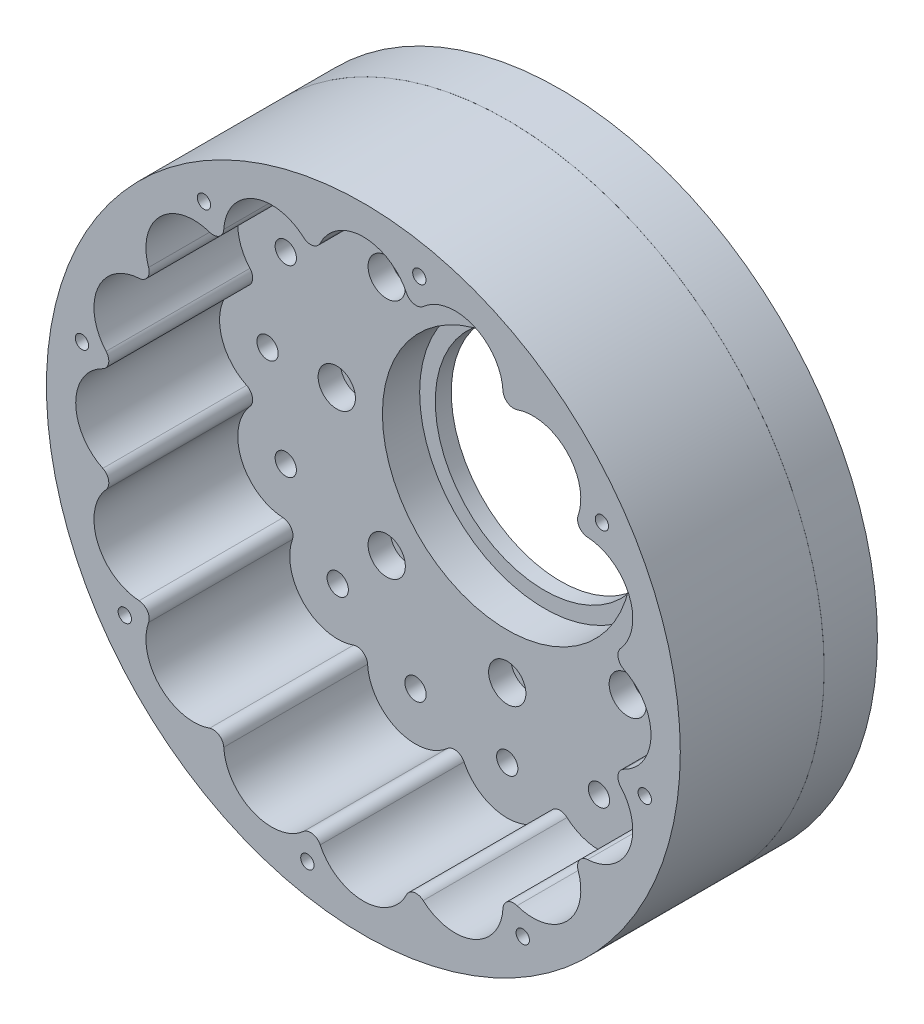
from build123d import *

# Parameters (mm, degrees)
SKETCH1_R           = 59.5
BOSS_EXTRUDE1_DEPTH = 10
SKETCH2_R           = 59.5
BOSS_EXTRUDE3_DEPTH = 27
SKETCH3_R           = 2
CUT_EXTRUDE1_DEPTH  = 4
SKETCH4_R           = 23.435
CUT_EXTRUDE2_DEPTH  = 7
SKETCH5_R           = 20.5
CUT_EXTRUDE3_DEPTH  = 91.755165142
SKETCH6_R           = 1.25
CUT_EXTRUDE4_DEPTH  = 22
FILLET1_R           = 2
SKETCH7_W           = 138.682388438
SKETCH7_H           = 126.163416563
CUT_EXTRUDE5_DEPTH  = 0.01
SKETCH8_R           = 3.5
CUT_EXTRUDE6_DEPTH  = 4.2
SKETCH9_R           = 2
CUT_EXTRUDE7_DEPTH  = 89.374431422


with BuildPart() as part:
    # Sketch1 → Boss-Extrude1 (new body)
    with BuildSketch(Plane.XY):
        Circle(SKETCH1_R)
    extrude(amount=BOSS_EXTRUDE1_DEPTH)

    # Sketch2 → Boss-Extrude3 (add)
    with BuildSketch(Plane.XY.offset(10)):
        Circle(SKETCH2_R)
        with BuildLine():
            ThreePointArc((45.231132339, -8.997031613), (54, 0), (45.231132339, 8.997031613))
            ThreePointArc((45.231132339, 8.997031613), (49.889494756, 20.664905348), (38.345102462, 25.621378334))
            ThreePointArc((38.345102462, 25.621378334), (38.183766184, 38.183766184), (25.621378334, 38.345102462))
            ThreePointArc((25.621378334, 38.345102462), (20.664905348, 49.889494756), (8.997031613, 45.231132339))
            ThreePointArc((8.997031613, 45.231132339), (0, 54), (-8.997031613, 45.231132339))
            ThreePointArc((-8.997031613, 45.231132339), (-20.664905348, 49.889494756), (-25.621378334, 38.345102462))
            ThreePointArc((-25.621378334, 38.345102462), (-38.183766184, 38.183766184), (-38.345102462, 25.621378334))
            ThreePointArc((-38.345102462, 25.621378334), (-49.889494756, 20.664905348), (-45.231132339, 8.997031613))
            ThreePointArc((-45.231132339, 8.997031613), (-54, 0), (-45.231132339, -8.997031613))
            ThreePointArc((-45.231132339, -8.997031613), (-49.889494756, -20.664905348), (-38.345102462, -25.621378334))
            ThreePointArc((-38.345102462, -25.621378334), (-38.183766184, -38.183766184), (-25.621378334, -38.345102462))
            ThreePointArc((-25.621378334, -38.345102462), (-20.664905348, -49.889494756), (-8.997031613, -45.231132339))
            ThreePointArc((-8.997031613, -45.231132339), (0, -54), (8.997031613, -45.231132339))
            ThreePointArc((8.997031613, -45.231132339), (20.664905348, -49.889494756), (25.621378334, -38.345102462))
            ThreePointArc((25.621378334, -38.345102462), (38.183766184, -38.183766184), (38.345102462, -25.621378334))
            ThreePointArc((38.345102462, -25.621378334), (49.889494756, -20.664905348), (45.231132339, -8.997031613))
        make_face(mode=Mode.SUBTRACT)
    extrude(amount=BOSS_EXTRUDE3_DEPTH)

    # Sketch3 → Cut-Extrude1 (cut)
    with BuildSketch(Plane.XY.offset(10)):
        with Locations((45, 0)):
            Circle(SKETCH3_R)
        with Locations((41.574578963, -17.220754456)):
            Circle(SKETCH3_R)
        with Locations((31.819805153, -31.819805153)):
            Circle(SKETCH3_R)
        with Locations((17.220754456, -41.574578963)):
            Circle(SKETCH3_R)
        with Locations((0, -45)):
            Circle(SKETCH3_R)
        with Locations((-17.220754456, -41.574578963)):
            Circle(SKETCH3_R)
        with Locations((-31.819805153, -31.819805153)):
            Circle(SKETCH3_R)
        with Locations((-41.574578963, -17.220754456)):
            Circle(SKETCH3_R)
        with Locations((-45, 0)):
            Circle(SKETCH3_R)
        with Locations((-41.574578963, 17.220754456)):
            Circle(SKETCH3_R)
        with Locations((-31.819805153, 31.819805153)):
            Circle(SKETCH3_R)
        with Locations((-17.220754456, 41.574578963)):
            Circle(SKETCH3_R)
        with Locations((0, 45)):
            Circle(SKETCH3_R)
        with Locations((17.220754456, 41.574578963)):
            Circle(SKETCH3_R)
        with Locations((31.819805153, 31.819805153)):
            Circle(SKETCH3_R)
        with Locations((41.574578963, 17.220754456)):
            Circle(SKETCH3_R)
    extrude(amount=-CUT_EXTRUDE1_DEPTH, mode=Mode.SUBTRACT)

    # Sketch4 → Cut-Extrude2 (cut)
    with BuildSketch(Plane.XY.offset(10)):
        Circle(SKETCH4_R)
    extrude(amount=-CUT_EXTRUDE2_DEPTH, mode=Mode.SUBTRACT)

    # Sketch5 → Cut-Extrude3 (cut, through all)
    with BuildSketch(Plane.XY.offset(3)):
        Circle(SKETCH5_R)
    extrude(amount=-CUT_EXTRUDE3_DEPTH, mode=Mode.SUBTRACT)

    # Sketch6 → Cut-Extrude4 (cut)
    with BuildSketch(Plane.XY.offset(37)):
        with Locations((44.782953319, 29.92301275)):
            Circle(SKETCH6_R)
        with Locations((52.825095203, -10.507564744)):
            Circle(SKETCH6_R)
        with Locations((29.92301275, -44.782953319)):
            Circle(SKETCH6_R)
        with Locations((-10.507564744, -52.825095203)):
            Circle(SKETCH6_R)
        with Locations((-44.782953319, -29.92301275)):
            Circle(SKETCH6_R)
        with Locations((-52.825095203, 10.507564744)):
            Circle(SKETCH6_R)
        with Locations((-29.92301275, 44.782953319)):
            Circle(SKETCH6_R)
        with Locations((10.507564744, 52.825095203)):
            Circle(SKETCH6_R)
    extrude(amount=-CUT_EXTRUDE4_DEPTH, mode=Mode.SUBTRACT)

    # Fillet1
    fillet1_edges = [part.edges().sort_by_distance(p)[0] for p in [
        (45.231132339, -8.997031613, 23.5),
        (45.231132339, 8.997031613, 23.5),
        (38.345102462, 25.621378334, 23.5),
        (25.621378334, 38.345102462, 23.5),
        (8.997031613, 45.231132339, 23.5),
        (-8.997031613, 45.231132339, 23.5),
        (-25.621378334, 38.345102462, 23.5),
        (-38.345102462, 25.621378334, 23.5),
        (-45.231132339, 8.997031613, 23.5),
        (-45.231132339, -8.997031613, 23.5),
        (-38.345102462, -25.621378334, 23.5),
        (-25.621378334, -38.345102462, 23.5),
        (-8.997031613, -45.231132339, 23.5),
        (8.997031613, -45.231132339, 23.5),
        (25.621378334, -38.345102462, 23.5),
        (38.345102462, -25.621378334, 23.5),
    ]]
    fillet(fillet1_edges, radius=FILLET1_R)

    # Sketch7 → Cut-Extrude5 (cut)
    with BuildSketch(Plane.XY.offset(10)):
        with Locations((-4.520739844, -0.904147969)):
            Rectangle(SKETCH7_W, SKETCH7_H)
    extrude(amount=-CUT_EXTRUDE5_DEPTH, mode=Mode.SUBTRACT)


with BuildPart() as cut_extrude5_piece_1:
    # of the separate pieces the step leaves, piece 1, a body of its own (cut_extrude5_pieces)
    add(part.part.solids().sort_by_distance((59.5, 0, 9.99))[0])

    # Sketch8 → Cut-Extrude6 (cut)
    with BuildSketch(Plane.XY.offset(9.99)):
        with Locations((32, 0)):
            Circle(SKETCH8_R)
        with Locations((22.627416998, -22.627416998)):
            Circle(SKETCH8_R)
        with Locations((0, -32)):
            Circle(SKETCH8_R)
        with Locations((-22.627416998, -22.627416998)):
            Circle(SKETCH8_R)
        with Locations((-32, 0)):
            Circle(SKETCH8_R)
        with Locations((-22.627416998, 22.627416998)):
            Circle(SKETCH8_R)
        with Locations((0, 32)):
            Circle(SKETCH8_R)
        with Locations((22.627416998, 22.627416998)):
            Circle(SKETCH8_R)
    extrude(amount=-CUT_EXTRUDE6_DEPTH, mode=Mode.SUBTRACT)

    # Sketch9 → Cut-Extrude7 (cut, through all)
    with BuildSketch(Plane.XY.offset(9.99)):
        with Locations((32, 0)):
            Circle(SKETCH9_R)
        with Locations((22.627416998, -22.627416998)):
            Circle(SKETCH9_R)
        with Locations((0, -32)):
            Circle(SKETCH9_R)
        with Locations((-22.627416998, -22.627416998)):
            Circle(SKETCH9_R)
        with Locations((-32, 0)):
            Circle(SKETCH9_R)
        with Locations((-22.627416998, 22.627416998)):
            Circle(SKETCH9_R)
        with Locations((0, 32)):
            Circle(SKETCH9_R)
        with Locations((22.627416998, 22.627416998)):
            Circle(SKETCH9_R)
    extrude(amount=-CUT_EXTRUDE7_DEPTH, mode=Mode.SUBTRACT)


with BuildPart() as cut_extrude5_piece_2:
    # of the separate pieces the step leaves, piece 2, a body of its own (cut_extrude5_pieces)
    add(part.part.solids().sort_by_distance((-40.319257579, -28.860192264, 37))[0])


solid = Compound([cut_extrude5_piece_1.part, cut_extrude5_piece_2.part])
